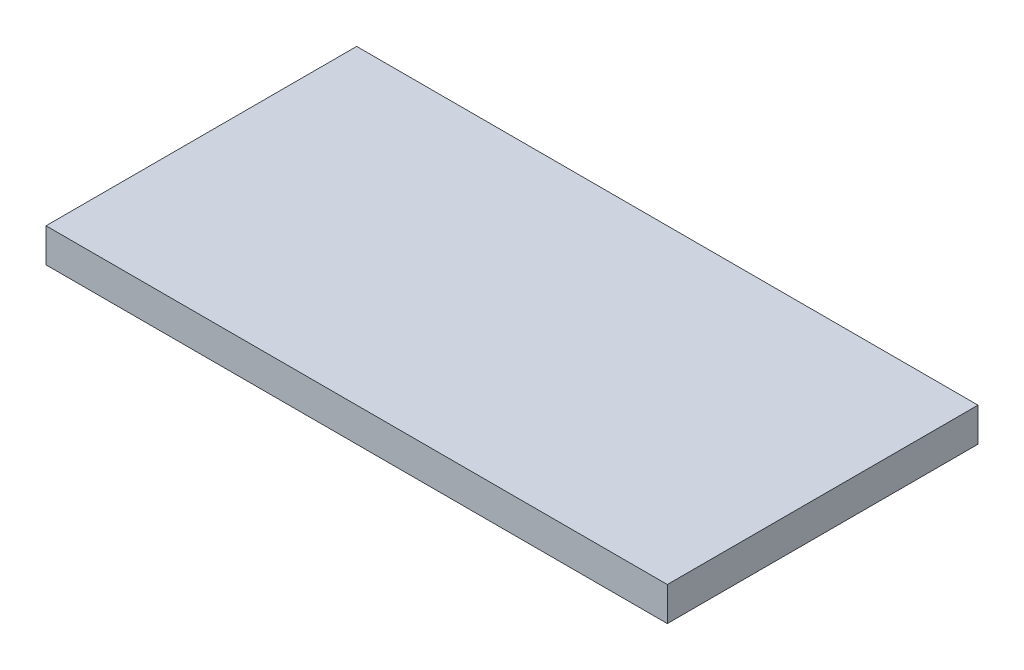
from build123d import *

# Parameters (mm, degrees)
RESSALTO_EXTRUS_O1_DEPTH = 58


with BuildPart() as part:
    # Esboço2 → Ressalto-extrusão1 (new body)
    with BuildSketch(Plane.XY):
        Polygon((-58, 0), (0, 0), (58, 0), (58, 6.32210553), (0, 6.32210553), (-58, 6.32210553), align=None)
    extrude(amount=-RESSALTO_EXTRUS_O1_DEPTH)


solid = part.part
